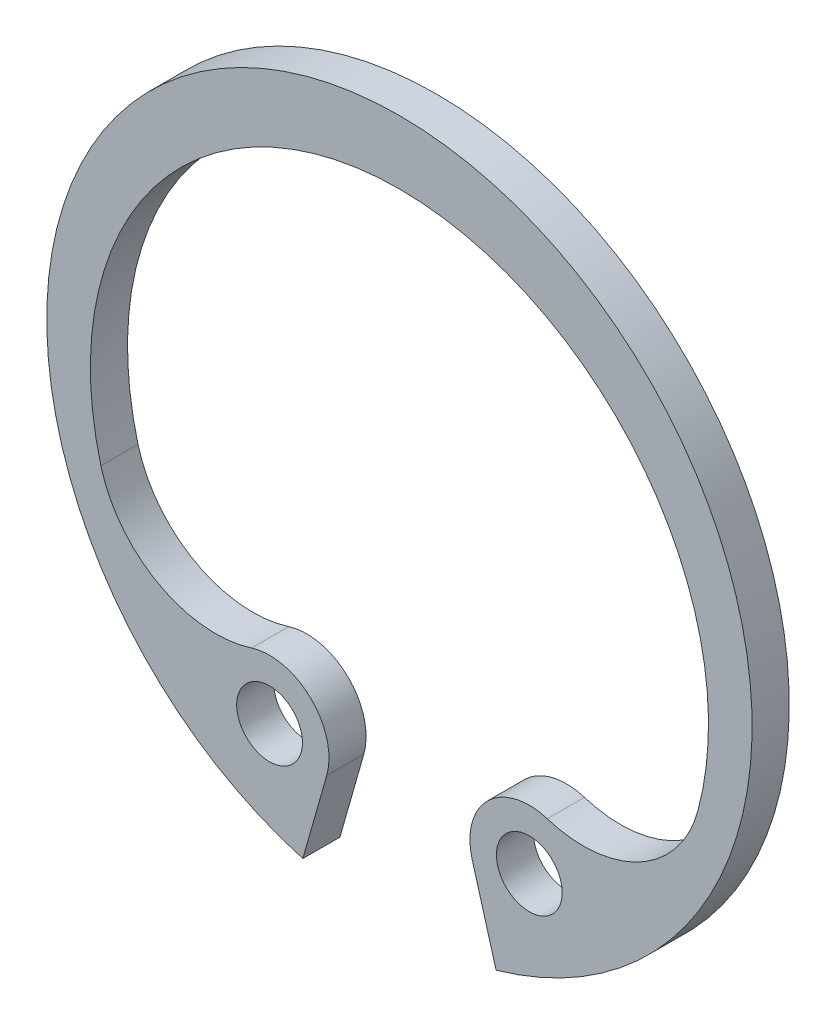
from build123d import *

# Parameters (mm, degrees)
ESQUISSE1_R        = 0.75480164
BOSS_EXTRU_1_DEPTH = 0.8521954


with BuildPart() as part:
    # Esquisse1 → Boss.-Extru.1 (new body)
    with BuildSketch(Plane.XY.offset(-0.0184023)):
        with BuildLine():
            Line((-2.218240991, -7.772182242), (-1.669933881, -5.847622743))
            ThreePointArc((-1.669933881, -5.847622743), (-2.031629427, -4.49557761), (-3.39387782, -4.174440527))
            ThreePointArc((-3.39387782, -4.174440527), (-5.528675736, -3.967277273), (-6.85337913, -2.280434165))
            ThreePointArc((-6.85337913, -2.280434165), (0, 6.648799775), (6.85337913, -2.280434165))
            ThreePointArc((6.85337913, -2.280434165), (5.528675736, -3.967277273), (3.39387782, -4.174440527))
            ThreePointArc((3.39387782, -4.174440527), (2.031629427, -4.49557761), (1.669933881, -5.847622743))
            Line((1.669933881, -5.847622743), (2.218240991, -7.772182242))
            ThreePointArc((2.218240991, -7.772182242), (0, 8.109706175), (-2.218240991, -7.772182242))
        make_face()
        with Locations((2.981265606, -5.47402426)):
            Circle(ESQUISSE1_R, mode=Mode.SUBTRACT)
        with Locations((-2.981265606, -5.47402426)):
            Circle(ESQUISSE1_R, mode=Mode.SUBTRACT)
    extrude(amount=-BOSS_EXTRU_1_DEPTH)


solid = part.part
